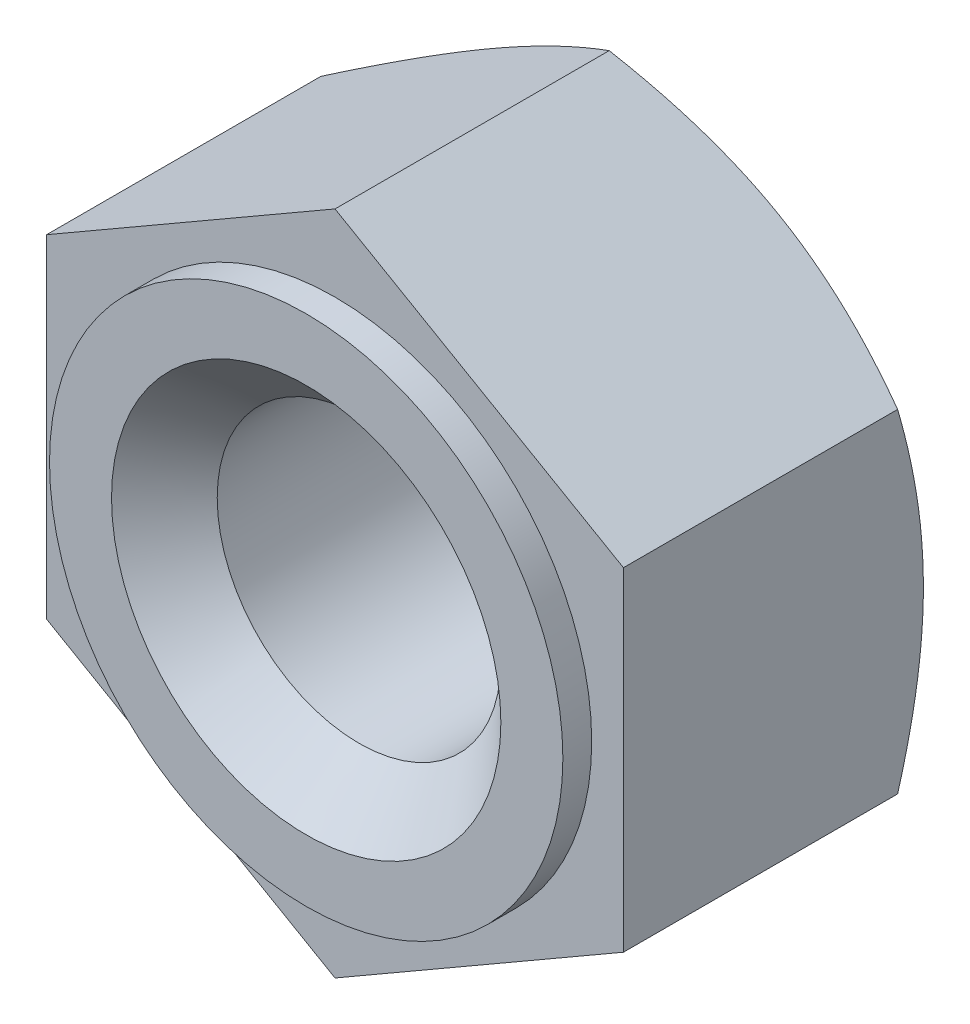
from build123d import *

# Parameters (mm, degrees)
SKETCH_1_R          = 2.45875
EXTRUDE_640_DEPTH   = 5.7
SKETCH_2_OUTSIDE_W  = 51.738
SKETCH_2_OUTSIDE_H  = 53.286
SKETCH_2_OUTSIDE_R  = 5
CUT_EXTRUDE_1_DEPTH = 10.530127666
CUT_EXTRUDE_1_DRAFT = -60
CHAMFER_1_SIZE      = 0.91625
SKETCH_3_OUTSIDE_W  = 51.738
SKETCH_3_OUTSIDE_H  = 53.286
SKETCH_3_OUTSIDE_R  = 5
CUT_EXTRUDE_2_DEPTH = 10.530127666
CUT_EXTRUDE_2_DRAFT = -60
SKETCH_4_R          = 8.9
SKETCH_4_R_2        = 4.45
CUT_EXTRUDE_3_DEPTH = 0.5


with BuildPart() as part:
    # 草图1 → Extrude 640 (new body)
    with BuildSketch(Plane.XY):
        Polygon((0, 5.773502692), (-5, 2.886751346), (-5, -2.886751346), (0, -5.773502692), (5, -2.886751346), (5, 2.886751346), align=None)
        Circle(SKETCH_1_R, mode=Mode.SUBTRACT)
    extrude(amount=EXTRUDE_640_DEPTH)


with BuildPart() as cut_extrude_1_tool:
    # 草图2 outside → 切除-拉伸1 (with draft: the straight prism first)
    with BuildSketch(Plane(origin=(0, 0, 0), x_dir=(-1, 0, 0), z_dir=(0, 0, -1))):
        Rectangle(SKETCH_2_OUTSIDE_W, SKETCH_2_OUTSIDE_H)
        Circle(SKETCH_2_OUTSIDE_R, mode=Mode.SUBTRACT)
    extrude(amount=-CUT_EXTRUDE_1_DEPTH)
    # 切除-拉伸1: the draft: its side faces are tilted about the plane it starts from
    cut_extrude_1_sides = [cut_extrude_1_tool.faces().sort_by_distance(p)[0] for p in [
        (0, -26.643, 5.265063833),
        (-25.869, 0, 5.265063833),
        (0, 26.643, 5.265063833),
        (25.869, 0, 5.265063833),
        (5, 0, 5.265063833),
    ]]
    draft(cut_extrude_1_sides, Plane(origin=(0, 0, 0), x_dir=(-1, 0, 0), z_dir=(0, 0, -1)), CUT_EXTRUDE_1_DRAFT)


with BuildPart() as part_1:
    add(part.part)

    # 切除-拉伸1: cut by cut_extrude_1_tool
    add(cut_extrude_1_tool.part, mode=Mode.SUBTRACT)

    # 倒角1
    chamfer_1_edges = [part_1.edges().sort_by_distance(p)[0] for p in [
        (-2.45875, 0, 0),
        (-2.45875, 0, 5.7),
    ]]
    chamfer(chamfer_1_edges, length=CHAMFER_1_SIZE)


with BuildPart() as cut_extrude_2_tool:
    # 草图3 outside → 切除-拉伸2 (with draft: the straight prism first)
    with BuildSketch(Plane.XY.offset(5.7)):
        Rectangle(SKETCH_3_OUTSIDE_W, SKETCH_3_OUTSIDE_H)
        Circle(SKETCH_3_OUTSIDE_R, mode=Mode.SUBTRACT)
    extrude(amount=-CUT_EXTRUDE_2_DEPTH)
    # 切除-拉伸2: the draft: its side faces are tilted about the plane it starts from
    cut_extrude_2_sides = [cut_extrude_2_tool.faces().sort_by_distance(p)[0] for p in [
        (0, -26.643, 0.434936167),
        (25.869, 0, 0.434936167),
        (0, 26.643, 0.434936167),
        (-25.869, 0, 0.434936167),
        (-5, 0, 0.434936167),
    ]]
    draft(cut_extrude_2_sides, Plane.XY.offset(5.7), CUT_EXTRUDE_2_DRAFT)


with BuildPart() as part_2:
    add(part_1.part)

    # 切除-拉伸2: cut by cut_extrude_2_tool
    add(cut_extrude_2_tool.part, mode=Mode.SUBTRACT)

    # 草图4 → 切除-拉伸3 (cut)
    with BuildSketch(Plane.XY.offset(5.7)):
        Circle(SKETCH_4_R)
        Circle(SKETCH_4_R_2, mode=Mode.SUBTRACT)
    extrude(amount=-CUT_EXTRUDE_3_DEPTH, mode=Mode.SUBTRACT)


solid = part_2.part
